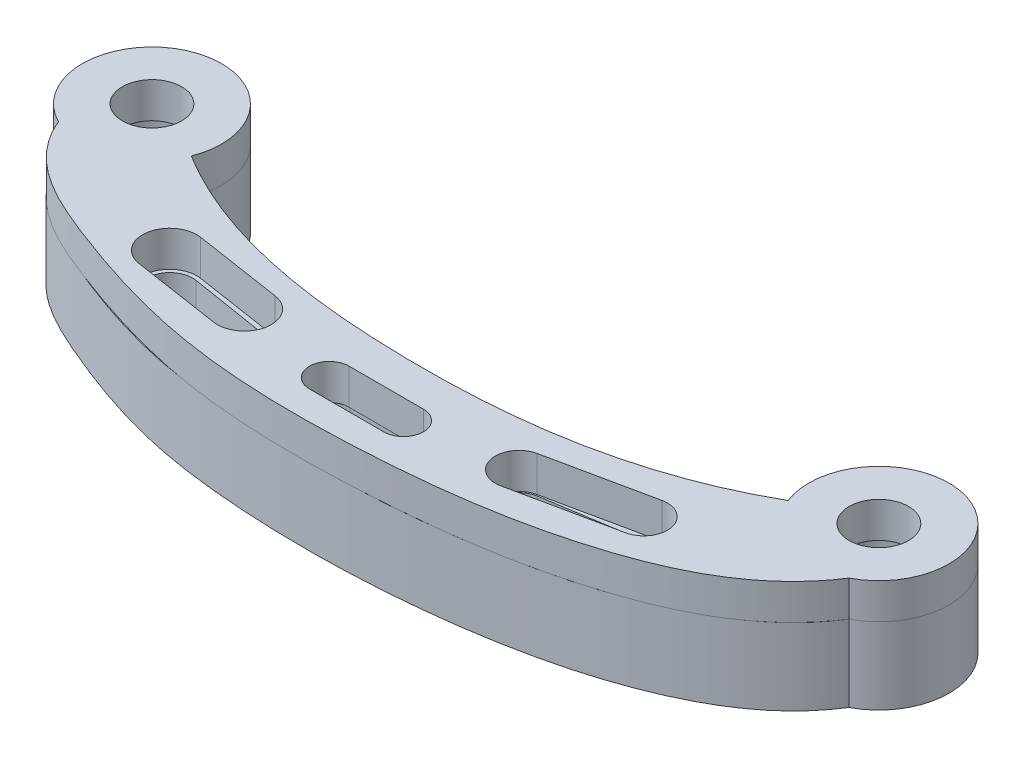
from build123d import *

# Parameters (mm, degrees)
SKETCH1_R           = 23.914626161
SKETCH1_R_2         = 27.045967385
BOSS_EXTRUDE1_DEPTH = 50
SCALE1_SCALE        = 0.129
SKETCH2_R           = 2.5
BOSS_EXTRUDE2_DEPTH = 3


with BuildPart() as part:
    # Sketch1 → Boss-Extrude1 (new body)
    with BuildSketch(Plane(origin=(0, 0, 0), x_dir=(1, 0, 0), z_dir=(0, 1, 0))):
        with BuildLine():
            ThreePointArc((571.425583032, 106.091006627), (566.486987495, 189.629943358), (507.659430695, 130.111356034))
            add(Edge.make_bspline(
                [(117.616005389, 130.111356034), (144.204175433, 106.457187383), (190.140627657, 101.864407344), (251.031237952, 86.215342563), (297.388019365, 86.131933075), (353.707264697, 84.167516941), (425.305720231, 96.17721663), (479.049506306, 111.535146669), (507.659430695, 130.111356034)],
                knots=[0, 0, 0, 0, 0.249670304, 0.333275294, 0.464807215, 0.590409482, 0.750006161, 1, 1, 1, 1], degree=3))
            ThreePointArc((117.616005389, 130.111356034), (58.983549296, 189.290353432), (54.766046274, 106.091006627))
            add(Edge.make_bspline(
                [(571.425583032, 106.091006627), (553.696805918, 77.53126711), (499.791617773, 45.759891324), (413.175222585, 24.948039658), (335.79505031, 17.702360032), (264.341352743, 18.472230801), (192.346991209, 26.140942246), (119.359983644, 51.307887822), (64.762558388, 78.873591576), (54.766046274, 106.091006627)],
                knots=[0, 0, 0, 0, 0.174458769, 0.318401703, 0.471929438, 0.585167873, 0.697862641, 0.852812349, 1, 1, 1, 1], degree=3))
        make_face()
        with Locations(Location((75.238108492, 146.759815529, 0), (0, 0, 270))):
            Circle(SKETCH1_R, mode=Mode.SUBTRACT)
        with Locations(Location((550.33805249, 146.759815529, 0), (0, 0, 270))):
            Circle(SKETCH1_R_2, mode=Mode.SUBTRACT)
        with BuildLine():
            Line((166.349894849, 84.502000807), (228.051186277, 74.47554095))
            ThreePointArc((228.051186277, 74.47554095), (240.503805912, 57.190561457), (223.218826419, 44.737941823))
            Line((223.218826419, 44.737941823), (161.517534991, 54.76440168))
            ThreePointArc((161.517534991, 54.76440168), (149.064915357, 72.049381173), (166.349894849, 84.502000807))
        make_face(mode=Mode.SUBTRACT)
        with BuildLine():
            Line((288.10756392, 63.463072101), (336.697330919, 63.463072101))
            ThreePointArc((336.697330919, 63.463072101), (350.409231268, 49.751171752), (336.697330919, 36.039271403))
            Line((336.697330919, 36.039271403), (288.10756392, 36.039271403))
            ThreePointArc((288.10756392, 36.039271403), (274.395663571, 49.751171752), (288.10756392, 63.463072101))
        make_face(mode=Mode.SUBTRACT)
        with BuildLine():
            Line((399.984344642, 73.929040649), (463.228168356, 83.955500506))
            ThreePointArc((463.228168356, 83.955500506), (479.821076039, 71.903809663), (467.769385196, 55.310901981))
            Line((467.769385196, 55.310901981), (404.525561482, 45.284442124))
            ThreePointArc((404.525561482, 45.284442124), (387.932653799, 57.336132967), (399.984344642, 73.929040649))
        make_face(mode=Mode.SUBTRACT)
    extrude(amount=BOSS_EXTRUDE1_DEPTH)


with BuildPart() as part_1:
    # Scale1: scaled about (0, 0, 0)
    add(part.part.scale(SCALE1_SCALE))


with BuildPart() as body_2:
    # Sketch2 → Boss-Extrude2 (new body)
    with BuildSketch(Plane(origin=(0, 6.45, 0), x_dir=(1, 0, 0), z_dir=(0, 1, 0))):
        with BuildLine():
            ThreePointArc((15.172464695, 16.784364928), (7.608877859, 24.418455593), (7.064819969, 13.685739855))
            add(Edge.make_bspline(
                [(7.064819969, 13.685739855), (8.699625863, 9.712450747), (16.300094229, 6.251497582), (29.024850934, 2.261026078), (44.257727724, 2.126809747), (60.420559919, 4.181195739), (70.74333497, 9.057181937), (73.713900211, 13.685739855)],
                knots=[0, 0, 0, 0, 0.164036027, 0.328594656, 0.550970823, 0.781411037, 1, 1, 1, 1], degree=3))
            ThreePointArc((73.713900211, 13.685739855), (73.076821387, 24.462262693), (65.48806656, 16.784364928))
            add(Edge.make_bspline(
                [(15.172464695, 16.784364928), (22.17757472, 12.442347393), (39.749105334, 9.85440517), (57.182599296, 12.057544833), (65.48806656, 16.784364928)],
                knots=[0, 0, 0, 0, 0.46554641, 1, 1, 1, 1], degree=3))
        make_face()
        with Locations(Location((9.705715995, 18.932016203, 0), (0, 0, 270))):
            Circle(SKETCH2_R, mode=Mode.SUBTRACT)
        with Locations(Location((70.993608771, 18.932016203, 0), (0, 0, 270))):
            Circle(SKETCH2_R, mode=Mode.SUBTRACT)
        with BuildLine():
            Line((21.4924466, 11.237160007), (28.926349197, 10.099567194))
            ThreePointArc((28.926349197, 10.099567194), (30.835828868, 7.500092772), (28.236354446, 5.590613101))
            Line((28.236354446, 5.590613101), (20.802451849, 6.728205914))
            ThreePointArc((20.802451849, 6.728205914), (18.892972178, 9.327680336), (21.4924466, 11.237160007))
        make_face(mode=Mode.SUBTRACT)
        with BuildLine():
            Line((37.165875746, 8.084242421), (43.433955689, 8.084242421))
            ThreePointArc((43.433955689, 8.084242421), (45.100296953, 6.417901156), (43.433955689, 4.751559891))
            Line((43.433955689, 4.751559891), (37.165875746, 4.751559891))
            ThreePointArc((37.165875746, 4.751559891), (35.499534481, 6.417901156), (37.165875746, 8.084242421))
        make_face(mode=Mode.SUBTRACT)
        with BuildLine():
            Line((51.478956048, 9.640215153), (60.165724042, 11.474385038))
            ThreePointArc((60.165724042, 11.474385038), (62.528602453, 9.935372422), (60.989589837, 7.57249401))
            Line((60.989589837, 7.57249401), (52.302821842, 5.738324125))
            ThreePointArc((52.302821842, 5.738324125), (49.939943431, 7.277336741), (51.478956048, 9.640215153))
        make_face(mode=Mode.SUBTRACT)
    extrude(amount=BOSS_EXTRUDE2_DEPTH)


solid = Compound([part_1.part, body_2.part])
